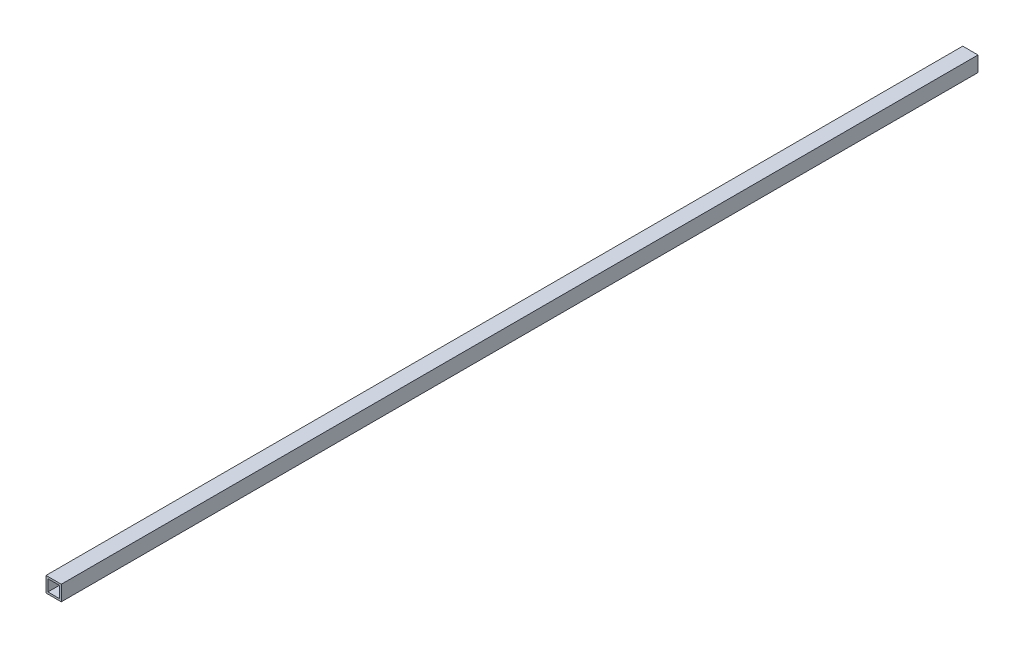
from build123d import *

# Parameters (mm, degrees)
BOSS_EXTRUDE1_DEPTH      = 381
BOSS_EXTRUDE1_DEPTH_BACK = 381
SKETCH1_W                = 12.7
SKETCH1_H                = 12.7
SKETCH1_W_2              = 9.525
SKETCH1_H_2              = 9.525


with BuildPart() as part:
    # Sketch1 → Boss-Extrude1 (new, two sides: drawn at the far end of the back side and taken through both)
    with BuildSketch(Plane.XY.offset(-BOSS_EXTRUDE1_DEPTH_BACK)):
        with Locations((323.85, 95.25)):
            Rectangle(SKETCH1_W, SKETCH1_H)
        with Locations((323.85, 95.25)):
            Rectangle(SKETCH1_W_2, SKETCH1_H_2, mode=Mode.SUBTRACT)
    extrude(amount=BOSS_EXTRUDE1_DEPTH + BOSS_EXTRUDE1_DEPTH_BACK)


solid = part.part
